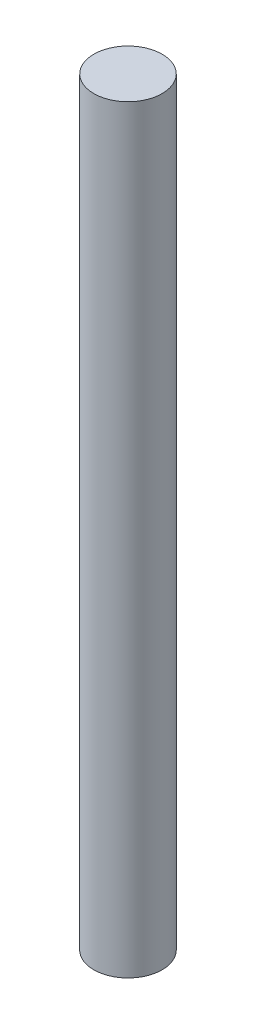
from build123d import *

# Parameters (mm, degrees)
SKETCH1_R      = 2.25
EXTRUDE1_DEPTH = 50


with BuildPart() as part:
    # Sketch1 → Extrude1 (new body)
    with BuildSketch(Plane(origin=(0, 0, 0), x_dir=(1, 0, 0), z_dir=(0, 1, 0))):
        with Locations(Location((0, 0, 0), (0, 0, 270))):
            Circle(SKETCH1_R)
    extrude(amount=EXTRUDE1_DEPTH)


solid = part.part
